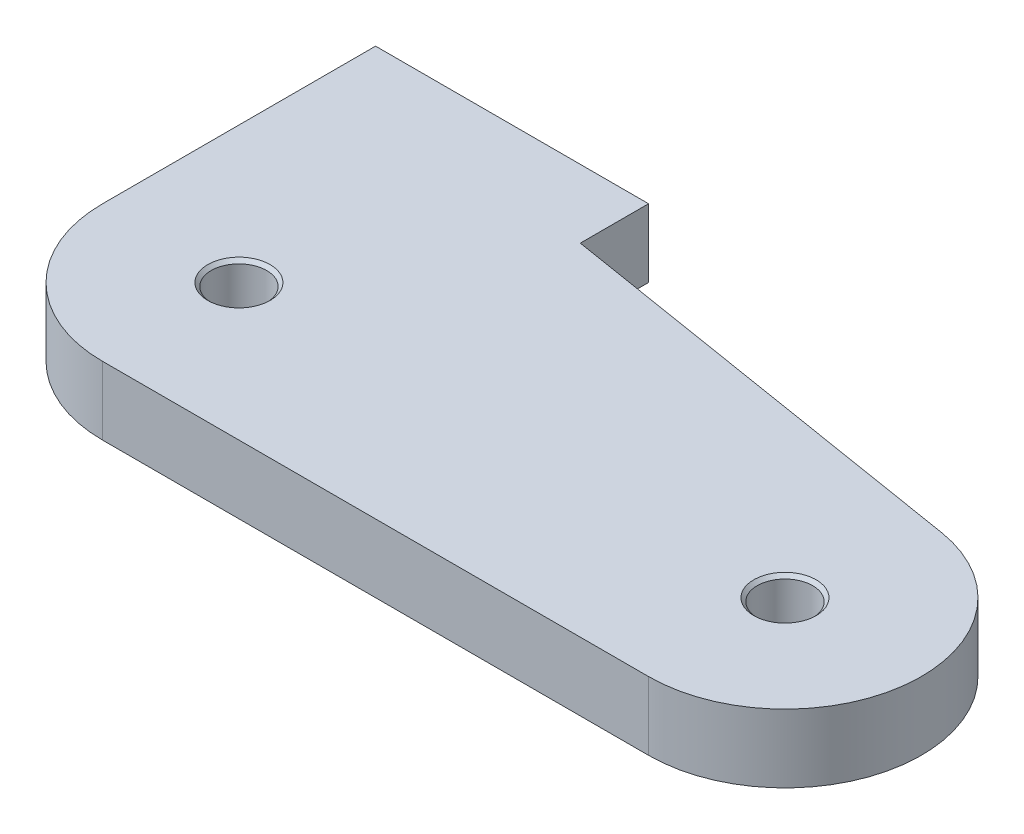
from build123d import *

# Parameters (mm, degrees)
BOSS_EXTRUDE2_DEPTH                        = 12.7
F_13_32_0_40625_DIAMETER_HOLE3_D           = 10.31875
F_13_32_0_40625_DIAMETER_HOLE3_CSINK_D     = 11.58875
F_13_32_0_40625_DIAMETER_HOLE3_CSINK_ANGLE = 90
F_13_32_0_40625_DIAMETER_HOLE2_D           = 10.31875
F_13_32_0_40625_DIAMETER_HOLE2_CSINK_D     = 11.58875
F_13_32_0_40625_DIAMETER_HOLE2_CSINK_ANGLE = 90


with BuildPart() as part:
    # Sketch1 → Boss-Extrude2 (new body)
    with BuildSketch(Plane(origin=(0, 0, 0), x_dir=(1, 0, 0), z_dir=(0, 1, 0))):
        with BuildLine():
            Line((0, 0), (101.6, 0))
            ThreePointArc((101.6, 0), (126.917817898, 23.358408246), (105.669972302, 50.471803395))
            Line((105.669972302, 50.471803395), (25.413803556, 63.5))
            Line((25.413803556, 63.5), (25.413803556, 76.2))
            Line((25.413803556, 76.2), (-25.386196444, 76.2))
            Line((-25.386196444, 76.2), (-25.386196444, 25.395653824))
            ThreePointArc((-25.386196444, 25.395653824), (-17.954095654, 7.438788683), (0, 0))
        make_face()
    extrude(amount=BOSS_EXTRUDE2_DEPTH)

    # 13/32 (0.40625) Diameter Hole3 (through all)
    with Locations(Plane(origin=(0, 12.7, 0), x_dir=(1, 0, 0), z_dir=(0, 1, 0))):
        with Locations((101.6, 25.4)):
            CounterSinkHole(F_13_32_0_40625_DIAMETER_HOLE3_D / 2, F_13_32_0_40625_DIAMETER_HOLE3_CSINK_D / 2, counter_sink_angle=F_13_32_0_40625_DIAMETER_HOLE3_CSINK_ANGLE)

    # 13/32 (0.40625) Diameter Hole2 (through all)
    with Locations(Plane(origin=(0, 12.7, 0), x_dir=(1, 0, 0), z_dir=(0, 1, 0))):
        with Locations((0, 25.386198205)):
            CounterSinkHole(F_13_32_0_40625_DIAMETER_HOLE2_D / 2, F_13_32_0_40625_DIAMETER_HOLE2_CSINK_D / 2, counter_sink_angle=F_13_32_0_40625_DIAMETER_HOLE2_CSINK_ANGLE)


solid = part.part
